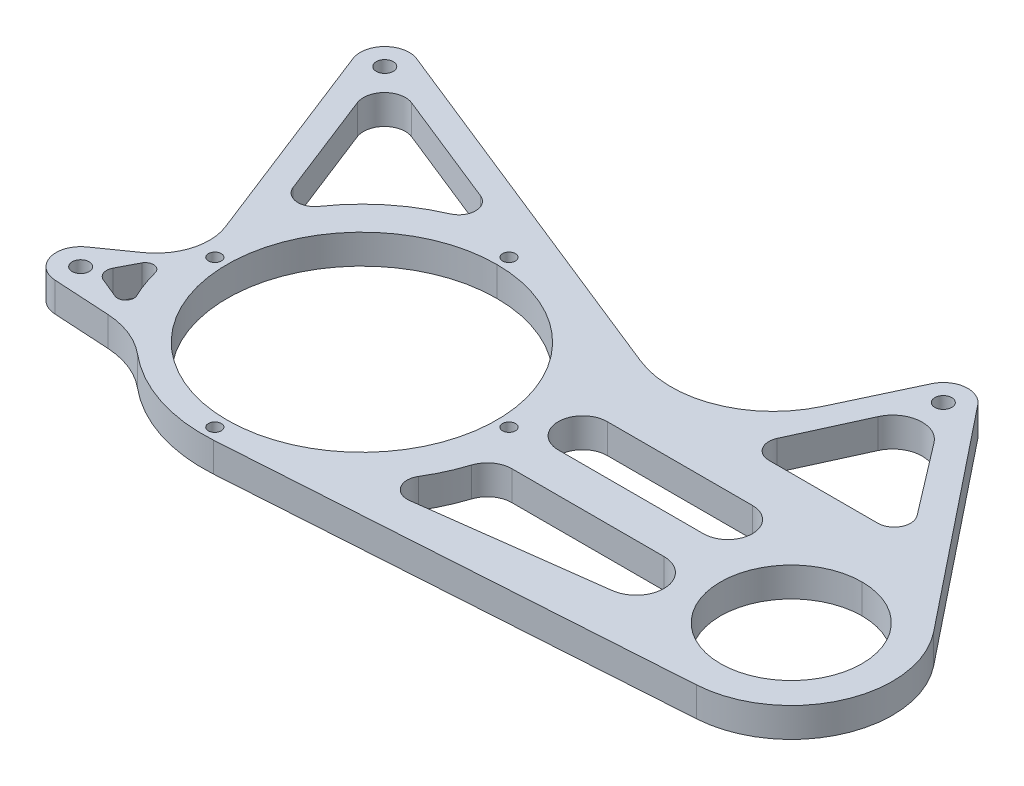
from build123d import *

# Parameters (mm, degrees)
SKETCH1_R             = 52.3875
SKETCH1_R_2           = 27.49999999
BOSS_EXTRUDE1_DEPTH   = 11.43
M6_CLEARANCE_HOLE1_D  = 6.6
F_5_0MM_DOWEL_HOLE1_D = 5
CIRPATTERN1_COUNT     = 4
CUT_EXTRUDE1_DEPTH    = 284.979078357
CUT_EXTRUDE2_DEPTH    = 284.979078357


with BuildPart() as part:
    # Sketch1 → Boss-Extrude1 (new body)
    with BuildSketch(Plane(origin=(0, 0, 0), x_dir=(1, 0, 0), z_dir=(0, 1, 0))):
        with BuildLine():
            Line((-207.974881785, -9.956762437), (-62.780706514, -68.14502812))
            ThreePointArc((-62.780706514, -68.14502812), (-33.518744337, -68.231765471), (-12.176603989, -48.212200061))
            Line((-12.176603989, -48.212200061), (1.412558245, -19.284326264))
            ThreePointArc((1.412558245, -19.284326264), (8.918983567, -13.874650788), (17.477288292, -17.391244328))
            Line((17.477288292, -17.391244328), (85.376811489, -102.435794114))
            ThreePointArc((85.376811489, -102.435794114), (90.622808309, -142.908316621), (57.171325793, -166.286594535))
            Line((57.171325793, -166.286594535), (-119.162108632, -177.782815552))
            ThreePointArc((-119.162108632, -177.782815552), (-142.381793832, -174.864306949), (-162.859406061, -163.53563224))
            ThreePointArc((-162.859406061, -163.53563224), (-171.795020191, -158.226569188), (-181.944164228, -155.984644639))
            Line((-181.944164228, -155.984644639), (-203.80853035, -154.713820713))
            ThreePointArc((-203.80853035, -154.713820713), (-212.414961885, -147.819468359), (-208.745100296, -137.420676408))
            Line((-208.745100296, -137.420676408), (-195.942175972, -128.392306479))
            ThreePointArc((-195.942175972, -128.392306479), (-187.978797318, -117.337243624), (-188.530006395, -103.72379502))
            Line((-188.530006395, -103.72379502), (-220.388836369, -22.267635732))
            ThreePointArc((-220.388836369, -22.267635732), (-218.225236723, -12.034965467), (-207.974881785, -9.956762437))
        make_face()
        with Locations(Location((-123.19, -116.001477372, 0), (0, 0, 270))):
            Circle(SKETCH1_R, mode=Mode.SUBTRACT)
        with Locations(Location((54.61, -127, 0), (0, 0, 270))):
            Circle(SKETCH1_R_2, mode=Mode.SUBTRACT)
    extrude(amount=BOSS_EXTRUDE1_DEPTH)

    # M6 Clearance Hole1 (through all)
    with Locations(Plane(origin=(0, 0, 0), x_dir=(-1, 0, 0), z_dir=(0, -1, 0))):
        with Locations((-10.033704867, -23.334197365), (211.518182886, -18.798178744), (203.255840963, -145.20486917)):
            Hole(M6_CLEARANCE_HOLE1_D / 2)

    # Ø5.0mm Dowel Hole1 (through all)
    with Locations(Plane(origin=(0, 0, 0), x_dir=(-1, 0, 0), z_dir=(0, -1, 0))):
        with Locations((123.19, -173.151477372)):
            f_5_0mm_dowel_hole1 = Hole(F_5_0MM_DOWEL_HOLE1_D / 2)

    # CirPattern1: Ø5.0mm Dowel Hole1 ×4 about axis
    cirpattern1_axis = Axis((-123.19, 0, 116.001477372), (0, 1, 0))
    for i in range(1, CIRPATTERN1_COUNT):
        add(f_5_0mm_dowel_hole1.rotate(cirpattern1_axis, i * 360 / CIRPATTERN1_COUNT), mode=Mode.SUBTRACT)

    # Sketch6 → Cut-Extrude1 (cut, through all)
    with BuildSketch(Plane.XZ):
        with BuildLine():
            Line((-10.182822689, 67.690666612), (2.086502597, 40.770912553))
            ThreePointArc((2.086502597, 40.770912553), (11.250375023, 34.121155358), (21.665234735, 38.562610722))
            Line((21.665234735, 38.562610722), (42.980839674, 66.469760223))
            ThreePointArc((42.980839674, 66.469760223), (43.626492897, 73.139052969), (37.934473227, 76.674197365))
            Line((37.934473227, 76.674197365), (-4.404672832, 76.674197365))
            ThreePointArc((-4.404672832, 76.674197365), (-9.745338534, 73.759279585), (-10.182822689, 67.690666612))
        make_face()
        with BuildLine():
            Line((-204.660650751, 36.331409888), (-188.626913597, 77.326218823))
            ThreePointArc((-188.626913597, 77.326218823), (-183.343464985, 81.400582198), (-177.265672517, 78.648182362))
            ThreePointArc((-177.265672517, 78.648182362), (-164.864290964, 65.181201114), (-149.229324423, 55.657458697))
            ThreePointArc((-149.229324423, 55.657458697), (-145.319075006, 49.625624375), (-149.386073966, 43.698348841))
            Line((-149.386073966, 43.698348841), (-194.042740287, 25.801666969))
            ThreePointArc((-194.042740287, 25.801666969), (-202.810079512, 27.579196728), (-204.660650751, 36.331409888))
        make_face()
        with BuildLine():
            Line((-194.372277693, 145.269385296), (-186.688929521, 148.427705402))
            ThreePointArc((-186.688929521, 148.427705402), (-183.165083403, 147.67403638), (-182.595670583, 144.11576749))
            ThreePointArc((-182.595670583, 144.11576749), (-184.933614825, 138.521979912), (-186.746150226, 132.736553552))
            ThreePointArc((-186.746150226, 132.736553552), (-189.47277077, 130.380487156), (-192.65433926, 132.072565879))
            Line((-192.65433926, 132.072565879), (-196.499963589, 139.435988897))
            ThreePointArc((-196.499963589, 139.435988897), (-196.72300396, 142.822067763), (-194.372277693, 145.269385296))
        make_face()
    extrude(amount=-CUT_EXTRUDE1_DEPTH, mode=Mode.SUBTRACT)

    # Sketch7 → Cut-Extrude2 (cut, through all)
    with BuildSketch(Plane.XZ):
        with BuildLine():
            Line((-48.815667356, 114.096477372), (7.572332644, 114.096477372))
            ThreePointArc((7.572332644, 114.096477372), (17.097332644, 104.571477372), (7.572332644, 95.046477372))
            Line((7.572332644, 95.046477372), (-48.815667356, 95.046477372))
            ThreePointArc((-48.815667356, 95.046477372), (-58.340667356, 104.571477372), (-48.815667356, 114.096477372))
        make_face()
        with BuildLine():
            Line((-60.709826633, 160.014824392), (8.969835923, 150.917653722))
            ThreePointArc((8.969835923, 150.917653722), (18.344598334, 139.513268885), (7.572332644, 129.418495204))
            Line((7.572332644, 129.418495204), (-51.525154545, 129.418495204))
            ThreePointArc((-51.525154545, 129.418495204), (-57.140513894, 131.249772802), (-60.59665397, 136.039442314))
            ThreePointArc((-60.59665397, 136.039442314), (-63.415414116, 143.322639291), (-67.078188304, 150.220062883))
            ThreePointArc((-67.078188304, 150.220062883), (-66.978480311, 157.122907335), (-60.709826633, 160.014824392))
        make_face()
    extrude(amount=-CUT_EXTRUDE2_DEPTH, mode=Mode.SUBTRACT)


solid = part.part
